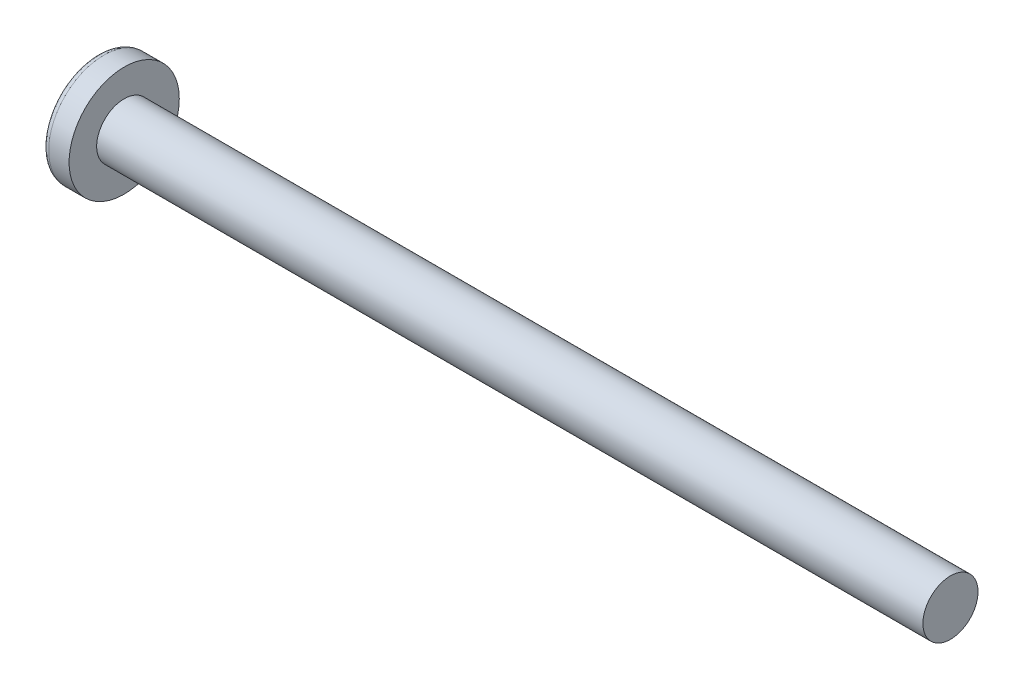
from build123d import *

# Parameters (mm, degrees)
CUT_EXTRUDE4_DEPTH = 2.5


with BuildPart() as part:
    # Sketch1 → Revolve1 (revolve)
    with BuildSketch(Plane.XY, mode=Mode.PRIVATE) as revolve1_sk:
        with BuildLine():
            Line((3.1, 2), (3.1, 4))
            Line((3.1, 4), (1.616353821, 4))
            ThreePointArc((1.616353821, 4), (1.397629036, 3.947269784), (1.226960106, 3.800664452))
            ThreePointArc((1.226960106, 3.800664452), (0.314340807, 1.996902688), (0, 0))
            Line((0, 0), (63.1, 0))
            Line((63.1, 0), (63.1, 2))
            Line((63.1, 2), (3.1, 2))
        make_face()
    revolve(revolve1_sk.sketch.rotate(Axis((63.1, 0, 0), (-1, 0, 0)), 90), axis=Axis((63.1, 0, 0), (-1, 0, 0)))

    # Sketch2 → Cut-Extrude4 (cut)
    with BuildSketch(Plane(origin=(0, 0, 0), x_dir=(0, 0, -1), z_dir=(1, 0, 0))):
        Polygon((-0.5, -0.5), (-0.5, -1.936491673), (0.5, -1.936491673), (0.5, -0.5), (1.936491673, -0.5), (1.936491673, 0.5), (0.5, 0.5), (0.5, 1.936491673), (-0.5, 1.936491673), (-0.5, 0.5), (-1.936491673, 0.5), (-1.936491673, -0.5), align=None)
    extrude(amount=CUT_EXTRUDE4_DEPTH, mode=Mode.SUBTRACT)


solid = part.part
